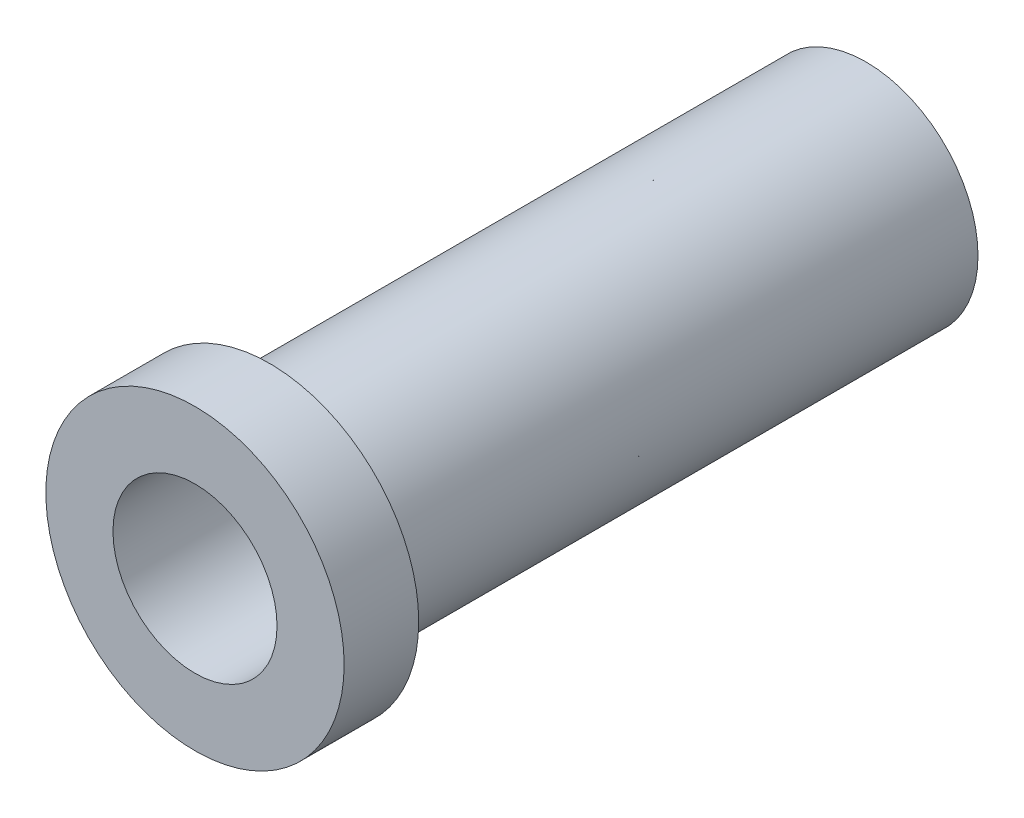
from build123d import *
from build123d.topology import SkipClean

# Parameters (mm, degrees)
SKETCH1_R           = 10
SKETCH1_R_2         = 5.5
BOSS_EXTRUDE1_DEPTH = 5
BOSS_EXTRUDE2_START = 40
SKETCH2_R           = 7.5
SKETCH2_R_2         = 5.5
BOSS_EXTRUDE2_DEPTH = 40


with BuildPart() as part:
    # Sketch1 → Boss-Extrude1 (new body)
    with BuildSketch(Plane.XY):
        Circle(SKETCH1_R)
        Circle(SKETCH1_R_2, mode=Mode.SUBTRACT)
    extrude(amount=BOSS_EXTRUDE1_DEPTH)

    # Sketch2 → Boss-Extrude2 (add)
    with SkipClean():  # the faces are left unmerged after this step: merging them gives an invalid solid
        with BuildSketch(Plane(origin=(0, 0, 0), x_dir=(-1, 0, 0), z_dir=(0, 0, -1)).offset(BOSS_EXTRUDE2_START)):
            with Locations(Location((0, 0, 0), (0, 0, 180))):
                Circle(SKETCH2_R)
            Circle(SKETCH2_R_2, mode=Mode.SUBTRACT)
        extrude(amount=-BOSS_EXTRUDE2_DEPTH)


solid = part.part
